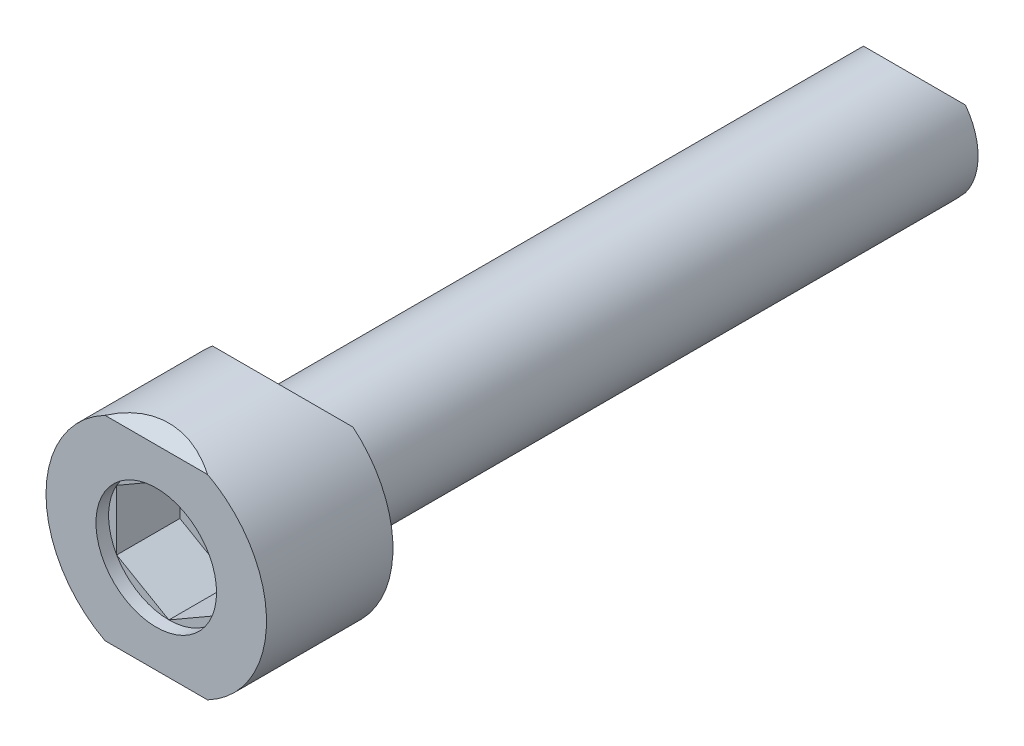
from build123d import *

# Parameters (mm, degrees)
BOSS_EXTRUDE1_DEPTH = 10
SKETCH2_OUTSIDE_W   = 18.56
SKETCH2_OUTSIDE_H   = 17.28
SKETCH2_OUTSIDE_R   = 4.36
CUT_EXTRUDE4_DEPTH  = 32.921929766
SKETCH3_R           = 2.384318612
CUT_EXTRUDE7_DEPTH  = 0.5
CUT_EXTRUDE8_DEPTH  = 2.5
SKETCH5_OUTSIDE_W   = 17.208
SKETCH5_OUTSIDE_H   = 17.208
SKETCH5_OUTSIDE_R   = 2.5
CUT_EXTRUDE9_DEPTH  = 25


with BuildPart() as part:
    # Sketch1 → Boss-Extrude1 (new body)
    with BuildSketch(Plane(origin=(0, 0, 0), x_dir=(0, 0, -1), z_dir=(1, 0, 0))):
        Polygon((11.5, -2.5), (-12.5, -2.5), (-12.5, -3.36), (-13.5, -4.36), (-17, -4.36), (-17.5, -3.86), (-17.5, 3.86), (-17, 4.36), (-13.5, 4.36), (-12.5, 3.36), (-12.5, 2.5), (11.5, 2.5), (12.5, 1.5), (12.5, -1.5), align=None)
    extrude(amount=BOSS_EXTRUDE1_DEPTH)

    # Sketch2 outside → Cut-Extrude4 (cut, through all)
    with BuildSketch(Plane.XY.offset(17.5)):
        with Locations((5, 0)):
            Rectangle(SKETCH2_OUTSIDE_W, SKETCH2_OUTSIDE_H)
        with Locations(Location((4.36, 0, 0), (0, 0, 339.876996719))):
            Circle(SKETCH2_OUTSIDE_R, mode=Mode.SUBTRACT)
    extrude(amount=-CUT_EXTRUDE4_DEPTH, mode=Mode.SUBTRACT)

    # Sketch3 → Cut-Extrude7 (cut)
    with BuildSketch(Plane.XY.offset(17.5)):
        with Locations((4.36, 0)):
            Circle(SKETCH3_R)
    extrude(amount=-CUT_EXTRUDE7_DEPTH, mode=Mode.SUBTRACT)

    # Sketch4 → Cut-Extrude8 (cut)
    with BuildSketch(Plane.XY.offset(17)):
        Polygon((4.36, 2.384318612), (2.295119511, 1.192159306), (2.295119511, -1.192159306), (4.36, -2.384318612), (6.424880489, -1.192159306), (6.424880489, 1.192159306), align=None)
    extrude(amount=-CUT_EXTRUDE8_DEPTH, mode=Mode.SUBTRACT)

    # Sketch5 outside → Cut-Extrude9 (cut)
    with BuildSketch(Plane(origin=(0, 0, -12.5), x_dir=(-1, 0, 0), z_dir=(0, 0, -1))):
        with Locations((-4.36, 0)):
            Rectangle(SKETCH5_OUTSIDE_W, SKETCH5_OUTSIDE_H)
        with Locations((-4.36, 0)):
            Circle(SKETCH5_OUTSIDE_R, mode=Mode.SUBTRACT)
    extrude(amount=-CUT_EXTRUDE9_DEPTH, mode=Mode.SUBTRACT)


solid = part.part
